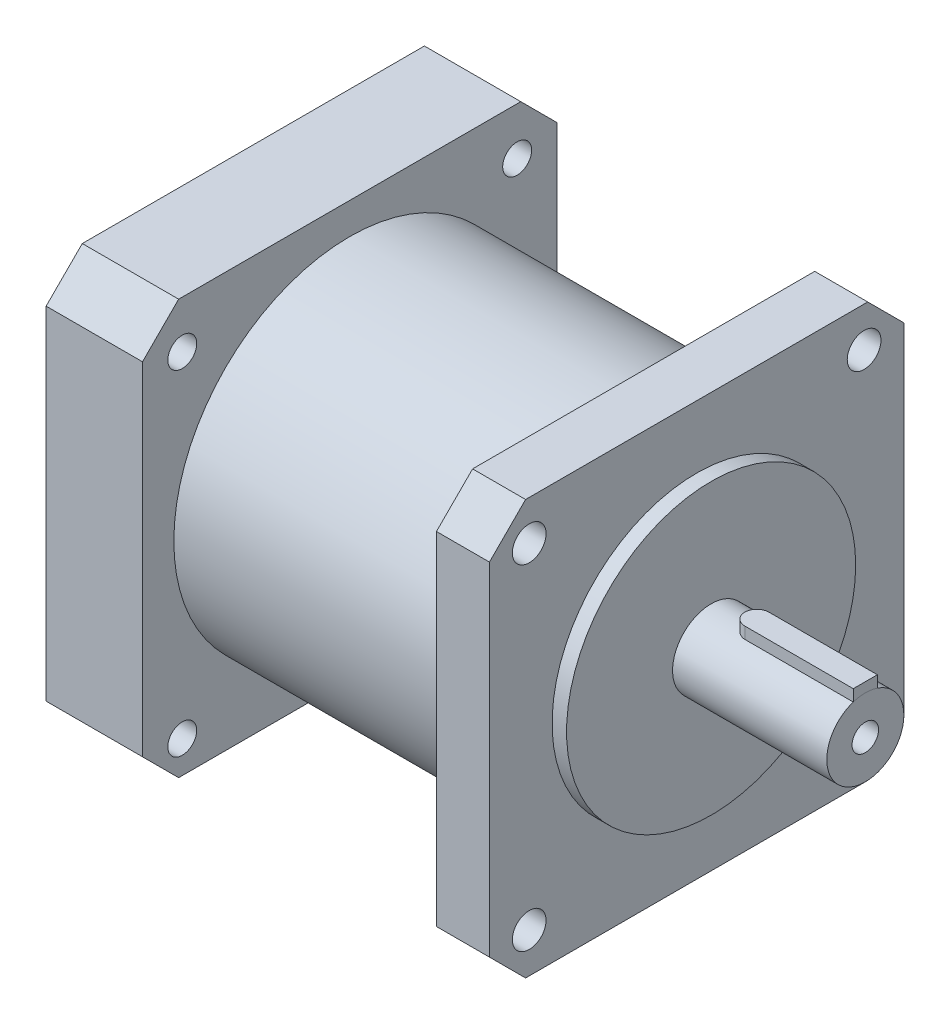
from build123d import *

# Parameters (mm, degrees)
SKETCH1_R               = 36.5
BOSS_EXTRUDE1_DEPTH     = 81
SKETCH1_3_W             = 86
SKETCH1_3_H             = 86
SKETCH1_3_R             = 36.5
BOSS_EXTRUDE2_DEPTH     = 20
CUT_EXTRUDE1_DEPTH      = 37
SKETCH4_W               = 86
SKETCH4_H               = 86
BOSS_EXTRUDE3_DEPTH     = 11
SKETCH5_R               = 30
BOSS_EXTRUDE4_DEPTH     = 3
SKETCH6_R               = 8
BOSS_EXTRUDE6_DEPTH     = 32
BOSS_EXTRUDE8_DEPTH     = 32
CUT_EXTRUDE3_REACH      = 146.177
CUT_EXTRUDE3_END_RADIUS = 8
CHAMFER1_SIZE           = 7.5
SKETCH13_R              = 3.5
CUT_EXTRUDE7_DEPTH      = 32
SKETCH14_R              = 3
CUT_EXTRUDE8_DEPTH      = 32
SKETCH16_R              = 2.75
CUT_EXTRUDE9_DEPTH      = 15


with BuildPart() as part:
    # Sketch1 → Boss-Extrude1 (new body)
    with BuildSketch(Plane(origin=(0, 0, 0), x_dir=(0, 0, -1), z_dir=(1, 0, 0))):
        Circle(SKETCH1_R)
    extrude(amount=BOSS_EXTRUDE1_DEPTH)

    # Sketch1<3> → Boss-Extrude2 (add)
    with BuildSketch(Plane(origin=(0, 0, 0), x_dir=(0, 0, -1), z_dir=(1, 0, 0))):
        Rectangle(SKETCH1_3_W, SKETCH1_3_H)
        Circle(SKETCH1_3_R, mode=Mode.SUBTRACT)
    extrude(amount=BOSS_EXTRUDE2_DEPTH)

    # Sketch2 → Cut-Extrude1 (cut)
    with BuildSketch(Plane.ZY):
        with BuildLine():
            Line((-2.5, 9.3), (2.5, 9.3))
            Line((2.5, 9.3), (2.5, 6.538348415))
            ThreePointArc((2.5, 6.538348415), (0, -7), (-2.5, 6.538348415))
            Line((-2.5, 6.538348415), (-2.5, 9.3))
        make_face()
    extrude(amount=-CUT_EXTRUDE1_DEPTH, mode=Mode.SUBTRACT)

    # Sketch4 → Boss-Extrude3 (add)
    with BuildSketch(Plane(origin=(81, 0, 0), x_dir=(0, 0, -1), z_dir=(1, 0, 0))):
        Rectangle(SKETCH4_W, SKETCH4_H)
    extrude(amount=BOSS_EXTRUDE3_DEPTH)

    # Sketch5 → Boss-Extrude4 (add)
    with BuildSketch(Plane(origin=(92, 0, 0), x_dir=(0, 0, -1), z_dir=(1, 0, 0))):
        Circle(SKETCH5_R)
    extrude(amount=BOSS_EXTRUDE4_DEPTH)

    # Sketch6 → Boss-Extrude6 (add)
    with BuildSketch(Plane(origin=(95, 0, 0), x_dir=(0, 0, -1), z_dir=(1, 0, 0))):
        Circle(SKETCH6_R)
    extrude(amount=BOSS_EXTRUDE6_DEPTH)

    # Chamfer1
    chamfer1_edges = [part.edges().sort_by_distance(p)[0] for p in [
        (10, -43, 43),
        (86.5, -43, 43),
        (86.5, -43, -43),
        (10, -43, -43),
        (10, 43, -43),
        (86.5, 43, -43),
        (86.5, 43, 43),
        (10, 43, 43),
    ]]
    chamfer(chamfer1_edges, length=CHAMFER1_SIZE)

    # Sketch13 → Cut-Extrude7 (cut)
    with BuildSketch(Plane(origin=(92, 0, 0), x_dir=(0, 0, -1), z_dir=(1, 0, 0))):
        with Locations((-34.75, -34.75)):
            Circle(SKETCH13_R)
        with Locations((34.75, -34.75)):
            Circle(SKETCH13_R)
        with Locations((34.75, 34.75)):
            Circle(SKETCH13_R)
        with Locations((-34.75, 34.75)):
            Circle(SKETCH13_R)
    extrude(amount=-CUT_EXTRUDE7_DEPTH, mode=Mode.SUBTRACT)

    # Sketch14 → Cut-Extrude8 (cut)
    with BuildSketch(Plane.ZY):
        with Locations((-34.75, -36.340956328)):
            Circle(SKETCH14_R)
        with Locations((34.75, -36.340956328)):
            Circle(SKETCH14_R)
        with Locations((34.75, 33.159043672)):
            Circle(SKETCH14_R)
        with Locations((-34.75, 33.159043672)):
            Circle(SKETCH14_R)
    extrude(amount=-CUT_EXTRUDE8_DEPTH, mode=Mode.SUBTRACT)

    # Sketch16 → Cut-Extrude9 (cut)
    with BuildSketch(Plane(origin=(127, 0, 0), x_dir=(0, 0, -1), z_dir=(1, 0, 0))):
        Circle(SKETCH16_R)
    extrude(amount=-CUT_EXTRUDE9_DEPTH, mode=Mode.SUBTRACT)


with BuildPart() as body_2:
    # Sketch8 → Boss-Extrude8 (new body)
    with BuildSketch(Plane(origin=(127, 0, 0), x_dir=(0, 0, -1), z_dir=(1, 0, 0))):
        with BuildLine():
            Line((2.5, 10), (-2.5, 10))
            Line((-2.5, 10), (-2.5, 7.599342077))
            ThreePointArc((-2.5, 7.599342077), (0, 8), (2.5, 7.599342077))
            Line((2.5, 7.599342077), (2.5, 10))
        make_face()
    extrude(amount=-BOSS_EXTRUDE8_DEPTH)

    # Cut-Extrude3: up to this cylinder (the profile starts outside it)
    cut_extrude3_end = Plane(origin=(98.788909, 0, 0), z_dir=(-1, 0, 0)) * Cylinder(CUT_EXTRUDE3_END_RADIUS, 309.354, mode=Mode.PRIVATE)
    # Sketch10 → Cut-Extrude3 (cut, up to the surface)
    with BuildSketch(Plane(origin=(0, 10, 0), x_dir=(1, 0, 0), z_dir=(0, 1, 0)), mode=Mode.PRIVATE) as cut_extrude3_sk1:
        with BuildLine():
            Line((104.5, -2.5), (95, -2.5))
            Line((95, -2.5), (95, 2.5))
            Line((95, 2.5), (104.5, 2.5))
            ThreePointArc((104.5, 2.5), (102, 0), (104.5, -2.5))
        make_face()
    cut_extrude3_tool1 = extrude(cut_extrude3_sk1.sketch, amount=-CUT_EXTRUDE3_REACH, mode=Mode.PRIVATE) - cut_extrude3_end
    add(cut_extrude3_tool1.solids().sort_by_distance((98.788909, 10, 0))[0], mode=Mode.SUBTRACT)


solid = Compound([part.part, body_2.part])
